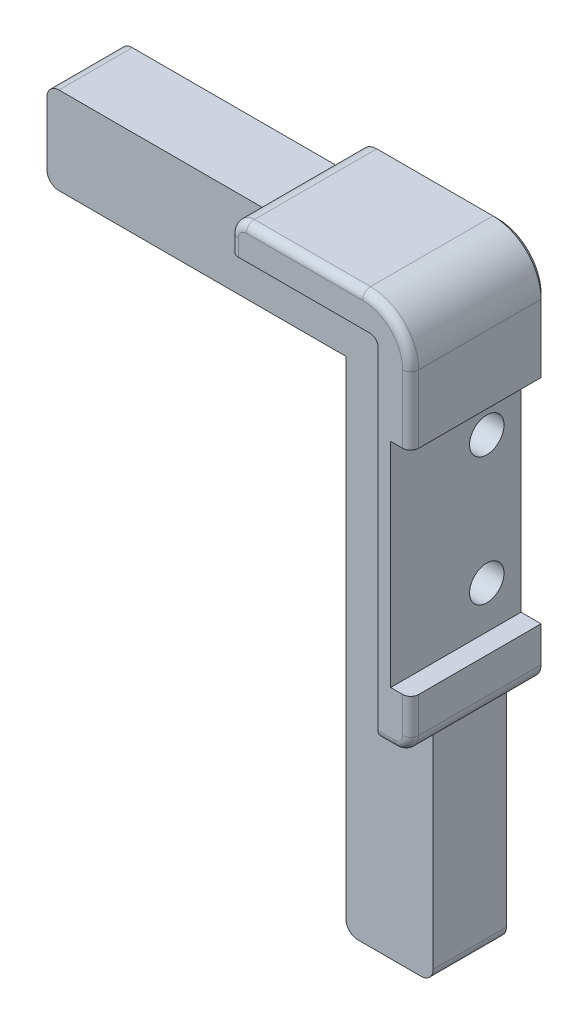
from build123d import *

# Parameters (mm, degrees)
BODY_AND_TONGUES_DEPTH     = 4.875
RIM_DEPTH                  = 8.435
BRACKET_SEAT_SKETCH_W      = 3.5
BRACKET_SEAT_SKETCH_H      = 26.6
BRACKET_SEAT_DEPTH         = 9.435
SCREW_PILOTS_SKETCH_R      = 2.15
SCREW_PILOTS_DEPTH         = 4.5
BUMPER_CORNER_R            = 6
INSIDE_CORNER_OF_THE_RIM_R = 1
RIM_ENDS_R                 = 2
TONGUE_LEAD_IN_R           = 1.5
RIM_TOP_EDGE_R             = 1
BED_FACE_CHAMFER_SIZE      = 0.6


with BuildPart() as part:
    # body and tongues sketch → body and tongues (new, symmetric)
    with BuildSketch(Plane.XY.offset(20.375)):
        Polygon((4.42, 7.07), (-18.08, 7.07), (-18.08, 2.75), (-48.08, 2.75), (-48.08, -8.13), (-10.78, -8.13), (-10.78, -70.43), (0.1, -70.43), (0.1, -40.43), (4.42, -40.43), align=None)
    extrude(amount=BODY_AND_TONGUES_DEPTH, both=True)

    # rim sketch → rim (add, symmetric)
    with BuildSketch(Plane.XY.offset(23.935)):
        Polygon((4.42, 7.07), (-18.08, 7.07), (-18.08, 3), (0.35, 3), (0.35, -40.43), (4.42, -40.43), align=None)
    extrude(amount=RIM_DEPTH, both=True)

    # bracket seat sketch → bracket seat (cut, symmetric)
    with BuildSketch(Plane.XY.offset(23.935)):
        with Locations((3.67, -20.7)):
            Rectangle(BRACKET_SEAT_SKETCH_W, BRACKET_SEAT_SKETCH_H)
    extrude(amount=BRACKET_SEAT_DEPTH, both=True, mode=Mode.SUBTRACT)

    # screw pilots sketch → screw pilots (cut, symmetric)
    with BuildSketch(Plane(origin=(-1.58, 0, 0), x_dir=(0, 0, -1), z_dir=(1, 0, 0))):
        with Locations((-20.375, -28.7)):
            Circle(SCREW_PILOTS_SKETCH_R)
        with Locations((-20.375, -12.7)):
            Circle(SCREW_PILOTS_SKETCH_R)
    extrude(amount=SCREW_PILOTS_DEPTH, both=True, mode=Mode.SUBTRACT)

    # bumper corner
    bumper_corner_edges = [part.edges().sort_by_distance(p)[0] for p in [
        (4.42, 7.07, 23.935),
    ]]
    fillet(bumper_corner_edges, radius=BUMPER_CORNER_R)

    # inside corner of the rim
    inside_corner_of_the_rim_edges = [part.edges().sort_by_distance(p)[0] for p in [
        (0.35, 3, 28.81),
    ]]
    fillet(inside_corner_of_the_rim_edges, radius=INSIDE_CORNER_OF_THE_RIM_R)

    # rim ends
    rim_ends_edges = [part.edges().sort_by_distance(p)[0] for p in [
        (4.42, -40.43, 23.935),
        (-18.08, 7.07, 23.935),
    ]]
    fillet(rim_ends_edges, radius=RIM_ENDS_R)

    # tongue lead-in
    tongue_lead_in_edges = [part.edges().sort_by_distance(p)[0] for p in [
        (0.1, -70.43, 20.375),
        (-10.78, -70.43, 20.375),
        (-48.08, -8.13, 20.375),
        (-48.08, 2.75, 20.375),
    ]]
    fillet(tongue_lead_in_edges, radius=TONGUE_LEAD_IN_R)

    # rim top edge
    rim_top_edge_edges = [part.edges().sort_by_distance(p)[0] for p in [
        (4.42, -36.215, 32.37),
        (2.662640687, 5.312640687, 32.37),
        (-18.08, 4.035, 32.37),
        (-17.494213562, 6.484213562, 32.37),
        (1.385, -40.43, 32.37),
        (3.834213562, -39.844213562, 32.37),
        (-8.83, 7.07, 32.37),
    ]]
    fillet(rim_top_edge_edges, radius=RIM_TOP_EDGE_R)

    # bed face chamfer
    bed_face_chamfer_edges = [part.edges().sort_by_distance(p)[0] for p in [
        (-10.78, -38.53, 15.5),
        (-10.340660172, -69.990660172, 15.5),
        (-5.34, -70.43, 15.5),
        (-0.339339828, -69.990660172, 15.5),
        (0.1, -54.68, 15.5),
        (1.26, -40.43, 15.5),
        (3.834213562, -39.844213562, 15.5),
        (4.42, -3.165, 15.5),
        (3.17, -34, 15.5),
        (1.92, -20.7, 15.5),
        (3.17, -7.4, 15.5),
        (2.662640687, 5.312640687, 15.5),
        (-8.83, 7.07, 15.5),
        (-17.494213562, 6.484213562, 15.5),
        (-18.08, 3.91, 15.5),
        (-32.33, 2.75, 15.5),
        (-47.640660172, 2.310660172, 15.5),
        (-48.08, -2.69, 15.5),
        (-47.640660172, -7.690660172, 15.5),
        (-28.68, -8.13, 15.5),
    ]]
    chamfer(bed_face_chamfer_edges, length=BED_FACE_CHAMFER_SIZE)


solid = part.part
